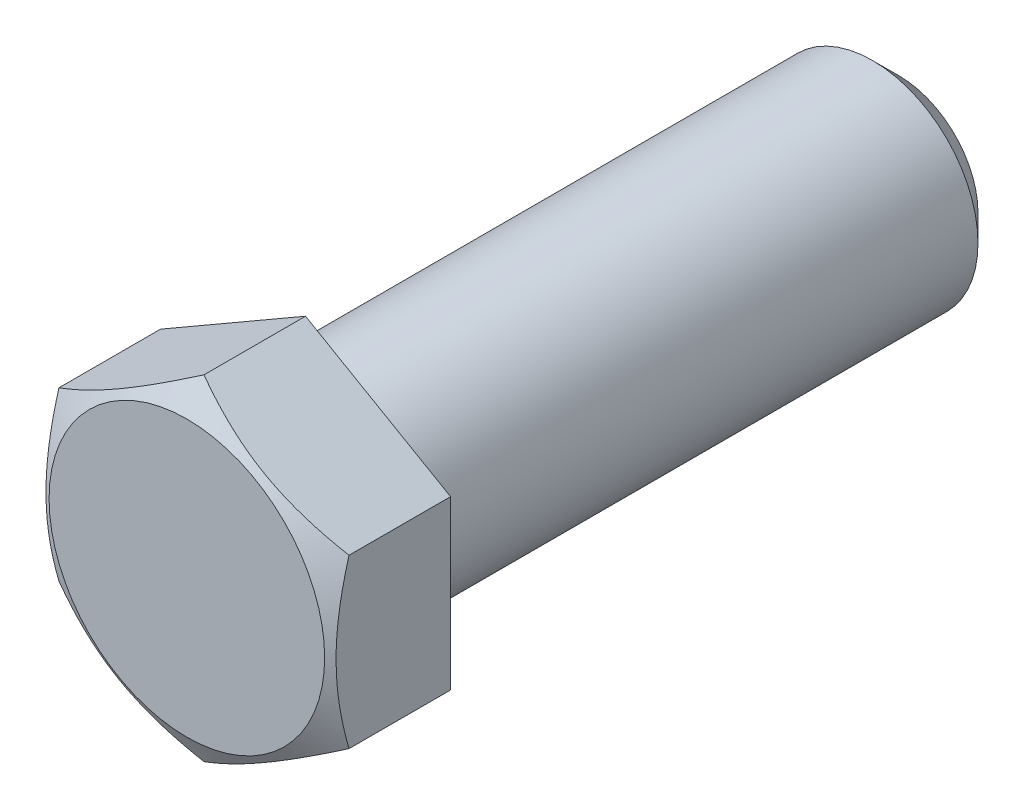
from build123d import *

# Parameters (mm, degrees)
EXTRUDE_337_DEPTH     = 9
SKETCH_D_OUTSIDE_W    = 65.598
SKETCH_D_OUTSIDE_H    = 69.002
SKETCH_D_OUTSIDE_R    = 10.45
CUT_EXTRUDE_379_DEPTH = 10
CUT_EXTRUDE_379_DRAFT = -60
SKETCH_398_R          = 8
EXTRUDE_460_DEPTH     = 45
CHAMFER_475_SIZE      = 2


with BuildPart() as part:
    # Sketch 332 → Extrude 337 (new body)
    with BuildSketch(Plane.XY):
        Polygon((0, -12.701705922), (11, -6.350852961), (11, 6.350852961), (0, 12.701705922), (-11, 6.350852961), (-11, -6.350852961), align=None)
    extrude(amount=EXTRUDE_337_DEPTH)


with BuildPart() as cut_extrude_379_tool:
    # D outside → Cut-Extrude 379 (with draft: the straight prism first)
    with BuildSketch(Plane.XY.offset(9)):
        Rectangle(SKETCH_D_OUTSIDE_W, SKETCH_D_OUTSIDE_H)
        Circle(SKETCH_D_OUTSIDE_R, mode=Mode.SUBTRACT)
    extrude(amount=-CUT_EXTRUDE_379_DEPTH)
    # Cut-Extrude 379: the draft: its side faces are tilted about the plane it starts from
    cut_extrude_379_sides = [cut_extrude_379_tool.faces().sort_by_distance(p)[0] for p in [
        (0, -34.501, 4),
        (32.799, 0, 4),
        (0, 34.501, 4),
        (-32.799, 0, 4),
        (-10.45, 0, 4),
    ]]
    draft(cut_extrude_379_sides, Plane.XY.offset(9), CUT_EXTRUDE_379_DRAFT)


with BuildPart() as part_1:
    add(part.part)

    # Cut-Extrude 379: cut by cut_extrude_379_tool
    add(cut_extrude_379_tool.part, mode=Mode.SUBTRACT)

    # Sketch 398 → Extrude 460 (add)
    with BuildSketch(Plane(origin=(0, 0, 0), x_dir=(-1, 0, 0), z_dir=(0, 0, -1))):
        with Locations(Location((0, 0, 0), (0, 0, 180))):
            Circle(SKETCH_398_R)
    extrude(amount=EXTRUDE_460_DEPTH)

    # Chamfer 475
    chamfer_475_edges = [part_1.edges().sort_by_distance(p)[0] for p in [
        (-8, 0, -45),
    ]]
    chamfer(chamfer_475_edges, length=CHAMFER_475_SIZE)


solid = part_1.part
